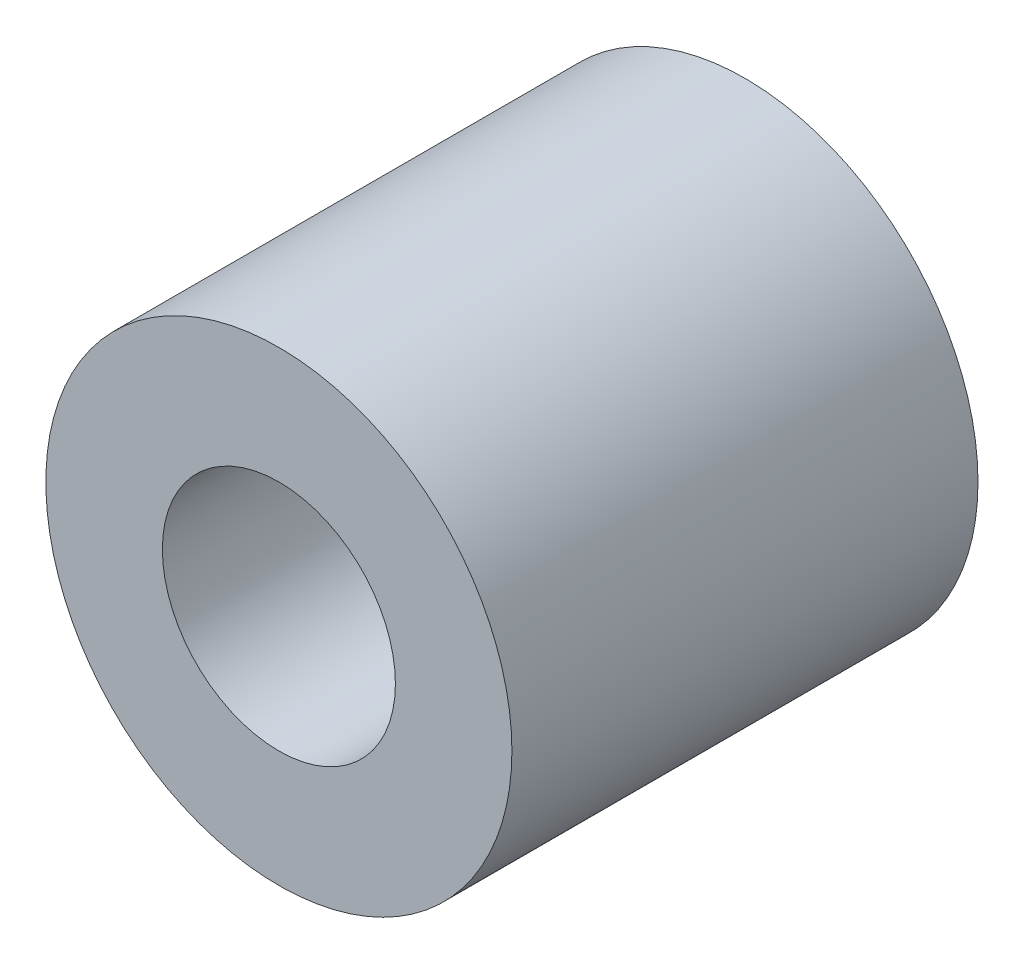
from build123d import *

# Parameters (mm, degrees)
SKETCH1_R           = 6.35
BOSS_EXTRUDE1_DEPTH = 12.7
SKETCH2_R           = 3.175
CUT_EXTRUDE1_DEPTH  = 12.7


with BuildPart() as part:
    # Sketch1 → Boss-Extrude1 (new body)
    with BuildSketch(Plane.XY):
        Circle(SKETCH1_R)
    extrude(amount=BOSS_EXTRUDE1_DEPTH)

    # Sketch2 → Cut-Extrude1 (cut)
    with BuildSketch(Plane.XY.offset(12.7)):
        Circle(SKETCH2_R)
    extrude(amount=-CUT_EXTRUDE1_DEPTH, mode=Mode.SUBTRACT)


solid = part.part
